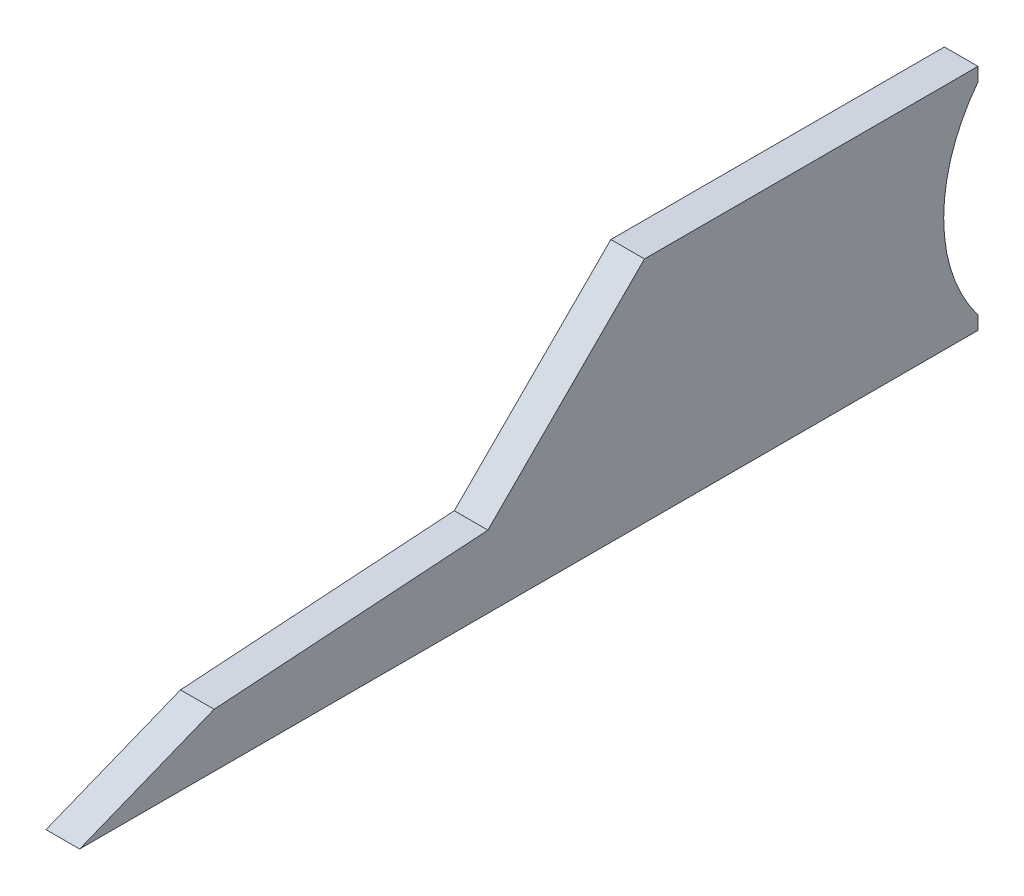
from build123d import *

# Parameters (mm, degrees)
BOSS_EXTRUDE1_DEPTH = 6.35
BOSS_EXTRUDE2_DEPTH = 6.35


with BuildPart() as part:
    # Sketch1 → Boss-Extrude1 (new body)
    with BuildSketch(Plane(origin=(0, 0, 0), x_dir=(0, 0, -1), z_dir=(1, 0, 0))):
        with BuildLine():
            Line((-106.172, 0), (-62.992, 43.18))
            Line((-62.992, 43.18), (0, 43.18))
            Line((0, 43.18), (0, 40.64))
            ThreePointArc((0, 40.64), (-6.479930943, 21.59), (0, 2.54))
            Line((0, 2.54), (0, 0))
            Line((0, 0), (-106.172, 0))
        make_face()
    extrude(amount=BOSS_EXTRUDE1_DEPTH)

    # Sketch2 → Boss-Extrude2 (add)
    with BuildSketch(Plane(origin=(6.35, 0, 0), x_dir=(0, 0, -1), z_dir=(1, 0, 0))):
        Polygon((-68.072, 0), (-169.672, 0), (-144.272, 10.16), (-68.072, 15.24), align=None)
    extrude(amount=-BOSS_EXTRUDE2_DEPTH)


solid = part.part
